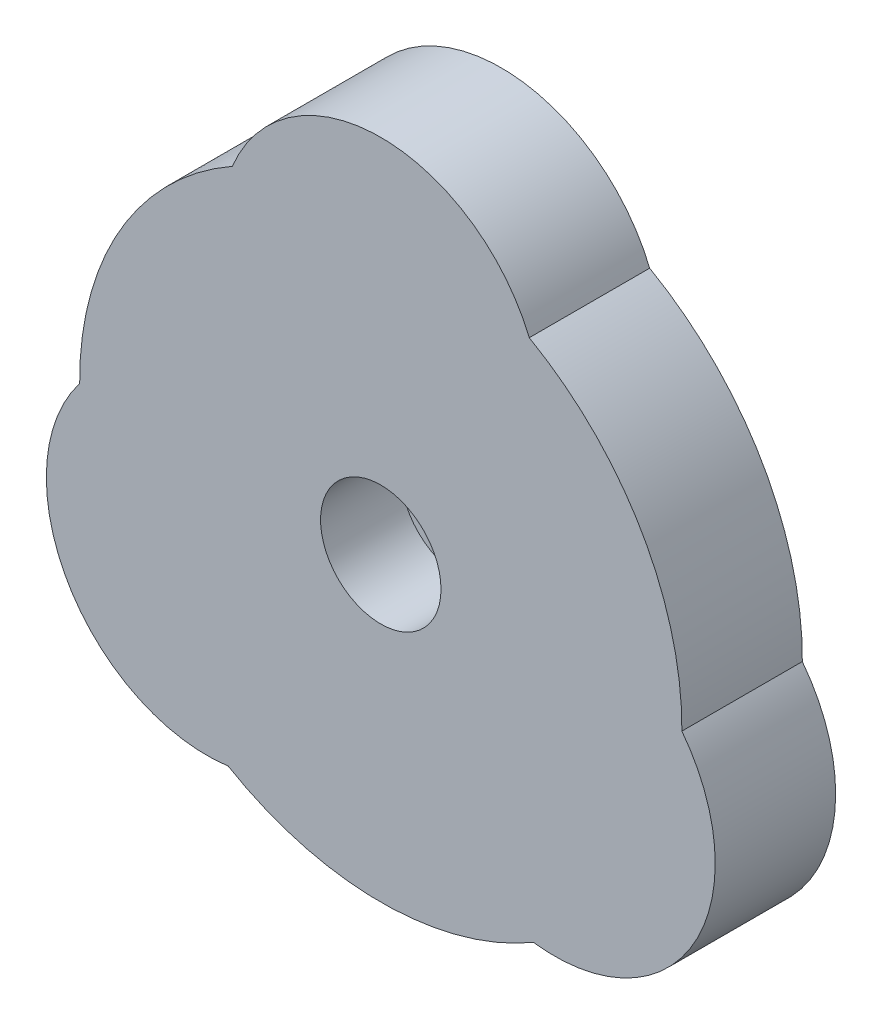
from build123d import *

# Parameters (mm, degrees)
ESQUISSE1_R             = 15
EXTRUSION1_DEPTH        = 6
ESQUISSE2_R             = 3
ENL_V_MAT_EXTRU_1_DEPTH = 4
EXTRUSION2_DEPTH        = 6


with BuildPart() as part:
    # Esquisse1 → Extrusion1 (new body)
    with BuildSketch(Plane.XY):
        Circle(ESQUISSE1_R)
    extrude(amount=EXTRUSION1_DEPTH)

    # Esquisse2 → Enlèv. mat.-Extru.1 (cut)
    with BuildSketch(Plane.XY.offset(6)):
        Circle(ESQUISSE2_R)
    extrude(amount=-ENL_V_MAT_EXTRU_1_DEPTH, mode=Mode.SUBTRACT)

    # Esquisse3 → Extrusion2 (add)
    with BuildSketch(Plane.XY.offset(6)):
        with BuildLine():
            Line((-8, 10), (8, 10))
            ThreePointArc((8, 10), (0, 18), (-8, 10))
        make_face()
        with BuildLine():
            Line((12.660254038, 1.92820323), (4.660254038, -11.92820323))
            ThreePointArc((4.660254038, -11.92820323), (15.588457268, -9), (12.660254038, 1.92820323))
        make_face()
        with BuildLine():
            Line((-4.660254038, -11.92820323), (-12.660254038, 1.92820323))
            ThreePointArc((-12.660254038, 1.92820323), (-15.588457268, -9), (-4.660254038, -11.92820323))
        make_face()
    extrude(amount=-EXTRUSION2_DEPTH)


solid = part.part
